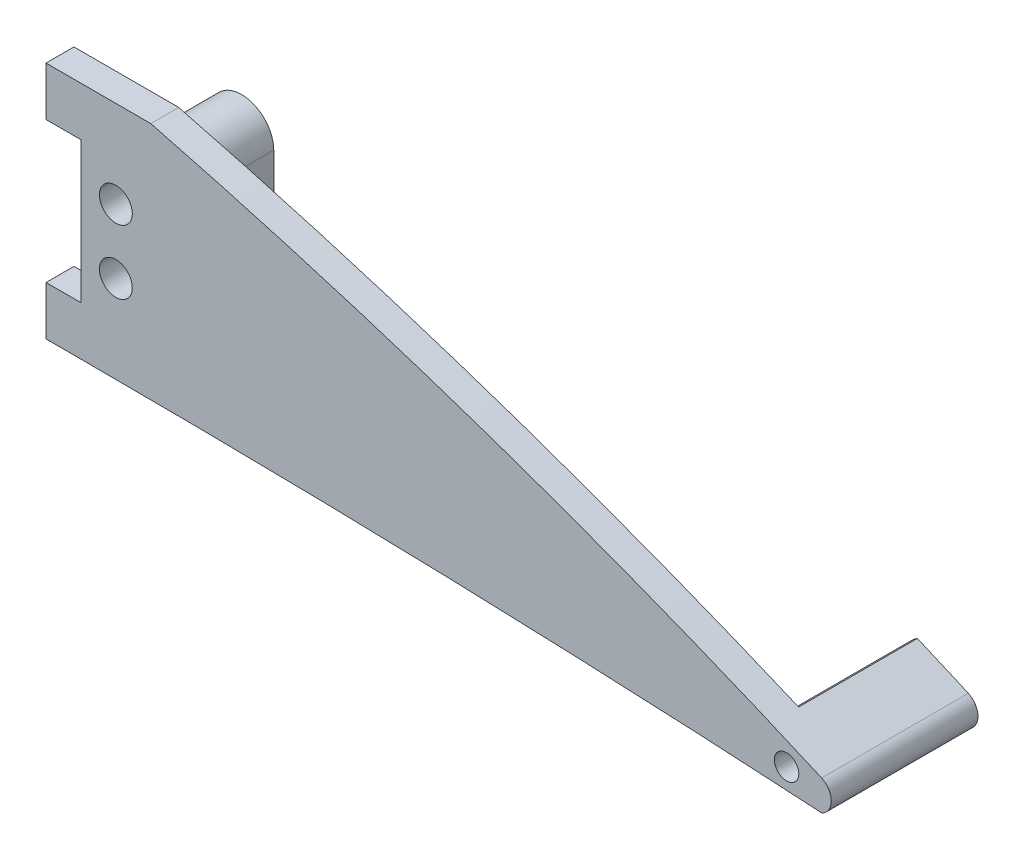
from build123d import *

# Parameters (mm, degrees)
SZKIC2_R                    = 2.35
DODANIE_WYCI_GNI_CIE1_DEPTH = 4
SZKIC3_R                    = 1.75
DODANIE_WYCI_GNI_CIE2_DEPTH = 17
DODANIE_WYCI_GNI_CIE3_DEPTH = 14
SZKIC6_R                    = 2.35
SZKIC6_R_2                  = 1.75
WYTNIJ_WYCI_GNI_CIE2_DEPTH  = 131.905876654


with BuildPart() as part:
    # Szkic2 → Dodanie-wyciągnięcie1 (new body)
    with BuildSketch(Plane.XY):
        with BuildLine():
            Line((15.2, 17.1), (15.2, 10.1))
            Line((15.2, 10.1), (20.2, 10.1))
            Line((20.2, 10.1), (20.2, -10.1))
            Line((20.2, -10.1), (15.2, -10.1))
            Line((15.2, -10.1), (15.2, -17.1))
            Line((15.2, -17.1), (19.197379501, -17.1))
            ThreePointArc((19.197379501, -17.1), (72.757727431, -17.908543704), (126.269263581, -20.333437957))
            ThreePointArc((126.269263581, -20.333437957), (127.600370297, -18.154974458), (126.216652739, -16.009543491))
            ThreePointArc((126.216652739, -16.009543491), (78.887653554, 2.515256091), (30.2, 17.1))
            Line((30.2, 17.1), (15.2, 17.1))
        make_face()
        with Locations(Location((25.2, 4.6, 0), (0, 0, 180))):
            Circle(SZKIC2_R, mode=Mode.SUBTRACT)
        with Locations((25.2, -4.6)):
            Circle(SZKIC2_R, mode=Mode.SUBTRACT)
    extrude(amount=DODANIE_WYCI_GNI_CIE1_DEPTH)

    # Szkic3 → Dodanie-wyciągnięcie2 (add)
    with BuildSketch(Plane.XY.offset(4)):
        with BuildLine():
            ThreePointArc((126.269263581, -20.333437957), (121.801544753, -20.069007105), (117.33317317, -19.815845914))
            ThreePointArc((117.33317317, -19.815845914), (116.687057134, -16.008461108), (118.922411718, -12.859360463))
            ThreePointArc((118.922411718, -12.859360463), (122.574580097, -14.42276365), (126.216652739, -16.009543491))
            ThreePointArc((126.216652739, -16.009543491), (127.600370297, -18.154974458), (126.269263581, -20.333437957))
        make_face()
        with Locations((121.2, -17.133437957)):
            Circle(SZKIC3_R, mode=Mode.SUBTRACT)
    extrude(amount=DODANIE_WYCI_GNI_CIE2_DEPTH)

    # Szkic5 → Dodanie-wyciągnięcie3 (add)
    with BuildSketch(Plane.XY.offset(4)):
        with BuildLine():
            Line((20.6, -4.6), (20.6, 4.6))
            ThreePointArc((20.6, 4.6), (25.2, 9.2), (29.8, 4.6))
            Line((29.8, 4.6), (29.8, -4.6))
            ThreePointArc((29.8, -4.6), (25.2, -9.2), (20.6, -4.6))
        make_face()
    extrude(amount=DODANIE_WYCI_GNI_CIE3_DEPTH)

    # Szkic6 → Wytnij-wyciągnięcie2 (cut, through all)
    with BuildSketch(Plane(origin=(0, 0, 0), x_dir=(-1, 0, 0), z_dir=(0, 0, -1))):
        with Locations(Location((-25.2, -4.6, 0), (0, 0, 180))):
            Circle(SZKIC6_R)
        with Locations((-25.2, 4.6)):
            Circle(SZKIC6_R)
        with Locations((-121.2, -17.133437957)):
            Circle(SZKIC6_R_2)
    extrude(amount=-WYTNIJ_WYCI_GNI_CIE2_DEPTH, mode=Mode.SUBTRACT)


with BuildPart() as body_2:
    # Lustro1: mirrored copy
    add(part.part.mirror(Plane(origin=(125.2, -18.184180883, 0), x_dir=(1, 0, 0), z_dir=(0, 0, -1))))


solid = body_2.part
